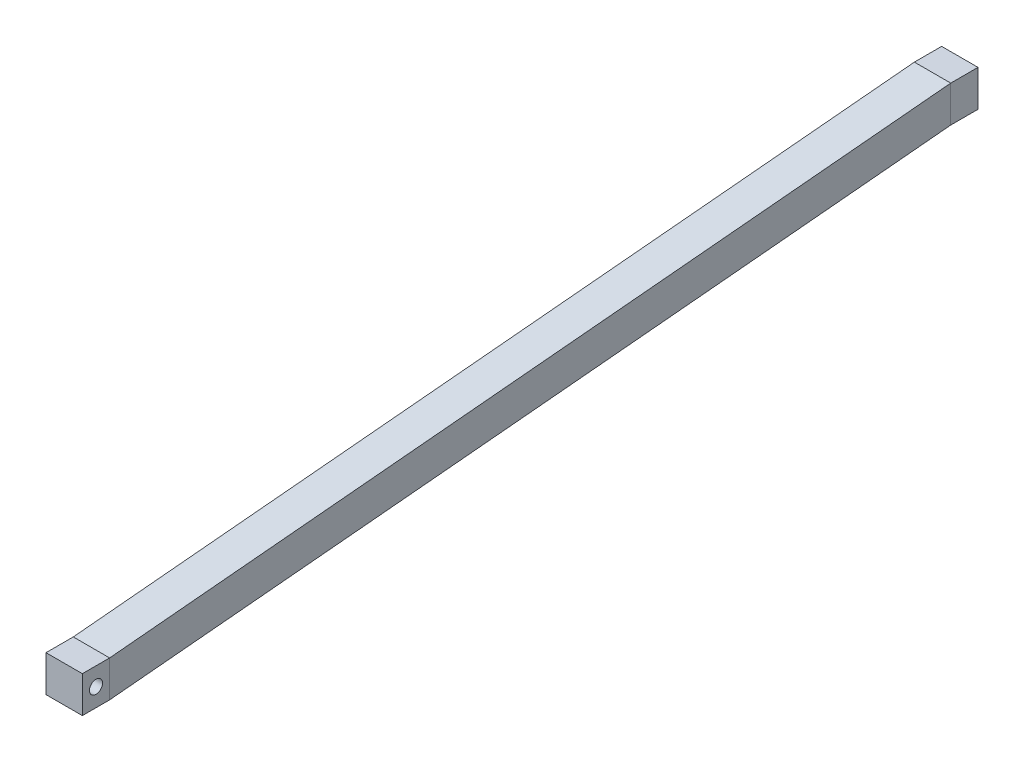
from build123d import *

# Parameters (mm, degrees)
SKETCH28_W          = 12.7
SKETCH28_H          = 12.7
BOSS_EXTRUDE5_DEPTH = 9.525
SKETCH29_W          = 12.7
SKETCH29_H          = 12.7
BOSS_EXTRUDE6_DEPTH = 9.525
SKETCH30_R          = 2.286
CUT_EXTRUDE7_DEPTH  = 270.036783662
SKETCH31_R          = 1.905
CUT_EXTRUDE8_DEPTH  = 12.7


with BuildPart() as part:
    # Sketch26 → Loft1 section 0
    with BuildSketch(Plane.XY):
        with BuildLine():
            Line((-6.35, 6.35), (6.35, 6.35))
            Line((6.35, 6.35), (6.35, -6.35))
            Line((6.35, -6.35), (-6.35, -6.35))
            Line((-6.35, -6.35), (-6.35, 6.35))
        make_face()
    # Sketch27 → Loft1 section 1
    with BuildSketch(Plane.XY.offset(238.245840754)):
        with BuildLine():
            Line((-49.2125, -88.9), (-61.9125, -88.9))
            Line((-61.9125, -88.9), (-61.9125, -76.2))
            Line((-61.9125, -76.2), (-49.2125, -76.2))
            Line((-49.2125, -76.2), (-49.2125, -88.9))
        make_face()
    loft()

    # Sketch28 → Boss-Extrude5 (add)
    with BuildSketch(Plane(origin=(0, 0, 0), x_dir=(-1, 0, 0), z_dir=(0, 0, -1))):
        Rectangle(SKETCH28_W, SKETCH28_H)
    extrude(amount=BOSS_EXTRUDE5_DEPTH)

    # Sketch29 → Boss-Extrude6 (add)
    with BuildSketch(Plane.XY.offset(238.245840754)):
        with Locations((-55.5625, -82.55)):
            Rectangle(SKETCH29_W, SKETCH29_H)
    extrude(amount=BOSS_EXTRUDE6_DEPTH)

    # Sketch30 → Cut-Extrude7 (cut, through all)
    with BuildSketch(Plane(origin=(-49.2125, 0, 0), x_dir=(0, 0, -1), z_dir=(1, 0, 0))):
        with Locations(Location((-243.008340754, -82.55, 0), (0, 0, 90))):
            Circle(SKETCH30_R)
    extrude(amount=-CUT_EXTRUDE7_DEPTH, mode=Mode.SUBTRACT)

    # Sketch31 → Cut-Extrude8 (cut)
    with BuildSketch(Plane(origin=(0, 0, -9.525), x_dir=(-1, 0, 0), z_dir=(0, 0, -1))):
        Circle(SKETCH31_R)
    extrude(amount=-CUT_EXTRUDE8_DEPTH, mode=Mode.SUBTRACT)


solid = part.part
